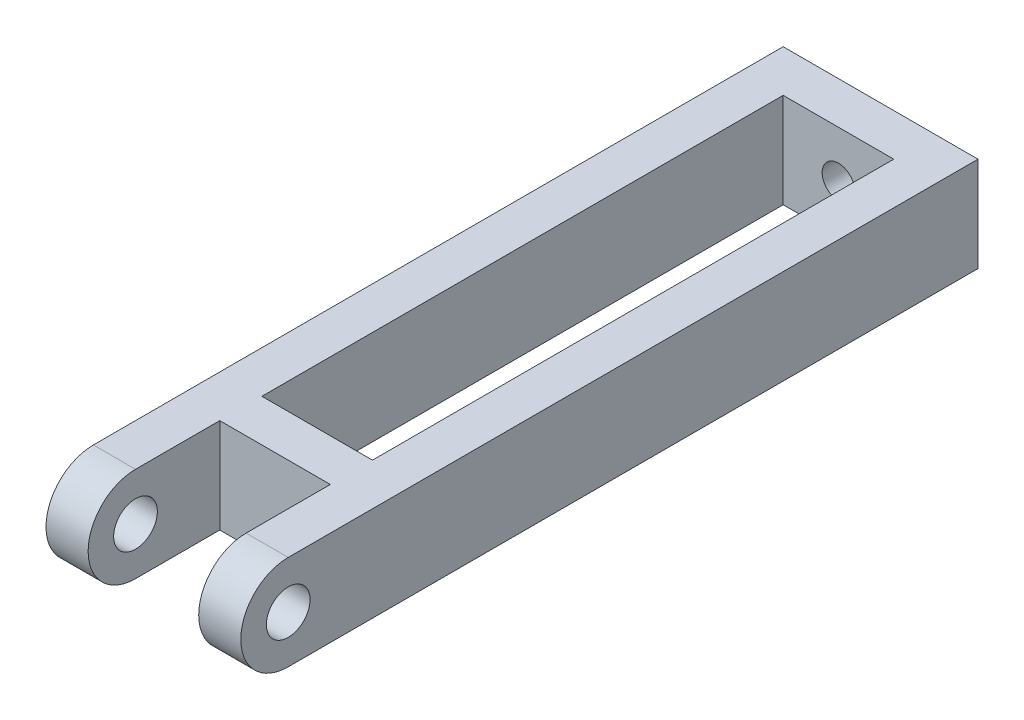
from build123d import *

# Parameters (mm, degrees)
SKETCH1_R               = 2.075
BOSS_EXTRUDE1_DEPTH     = 4
SKETCH2_W               = 57.5
SKETCH2_H               = 9
BOSS_EXTRUDE2_DEPTH     = 5.25
CUT_EXTRUDE1_DEPTH      = 11
CUT_EXTRUDE1_DEPTH_BACK = 11
SKETCH3_W               = 10.5
SKETCH3_H               = 49.5
SKETCH4_R               = 1.55
CUT_EXTRUDE2_DEPTH      = 11


with BuildPart() as part:
    # Sketch1 → Boss-Extrude1 (new body)
    with BuildSketch(Plane(origin=(0, 0, 0), x_dir=(0, 0, -1), z_dir=(1, 0, 0))):
        with BuildLine():
            Line((0, 4.5), (65.5, 4.5))
            Line((65.5, 4.5), (65.5, -4.5))
            Line((65.5, -4.5), (0, -4.5))
            ThreePointArc((0, -4.5), (-4.5, 0), (0, 4.5))
        make_face()
        Circle(SKETCH1_R, mode=Mode.SUBTRACT)
    extrude(amount=-BOSS_EXTRUDE1_DEPTH)

    # Sketch2 → Boss-Extrude2 (add)
    with BuildSketch(Plane(origin=(0, 0, 0), x_dir=(0, 0, -1), z_dir=(1, 0, 0))):
        with Locations((36.75, 0)):
            Rectangle(SKETCH2_W, SKETCH2_H)
    extrude(amount=BOSS_EXTRUDE2_DEPTH)

    # Mirror2: part across plane


with BuildPart() as part_1:
    add(part.part)
    add(part.part.mirror(Plane(origin=(5.25, 0, 0), x_dir=(0, 0, 1), z_dir=(1, 0, 0))))

    # Sketch3 → Cut-Extrude1 (cut, two sides: drawn at the far end of the back side and taken through both)
    with BuildSketch(Plane(origin=(0, 0, 0), x_dir=(1, 0, 0), z_dir=(0, 1, 0)).offset(-CUT_EXTRUDE1_DEPTH_BACK)):
        with Locations((5.25, 36.75)):
            Rectangle(SKETCH3_W, SKETCH3_H)
    extrude(amount=CUT_EXTRUDE1_DEPTH + CUT_EXTRUDE1_DEPTH_BACK, mode=Mode.SUBTRACT)

    # Sketch4 → Cut-Extrude2 (cut)
    with BuildSketch(Plane.XY.offset(-60)):
        with Locations((5.25, 0)):
            Circle(SKETCH4_R)
    extrude(amount=-CUT_EXTRUDE2_DEPTH, mode=Mode.SUBTRACT)


solid = part_1.part
